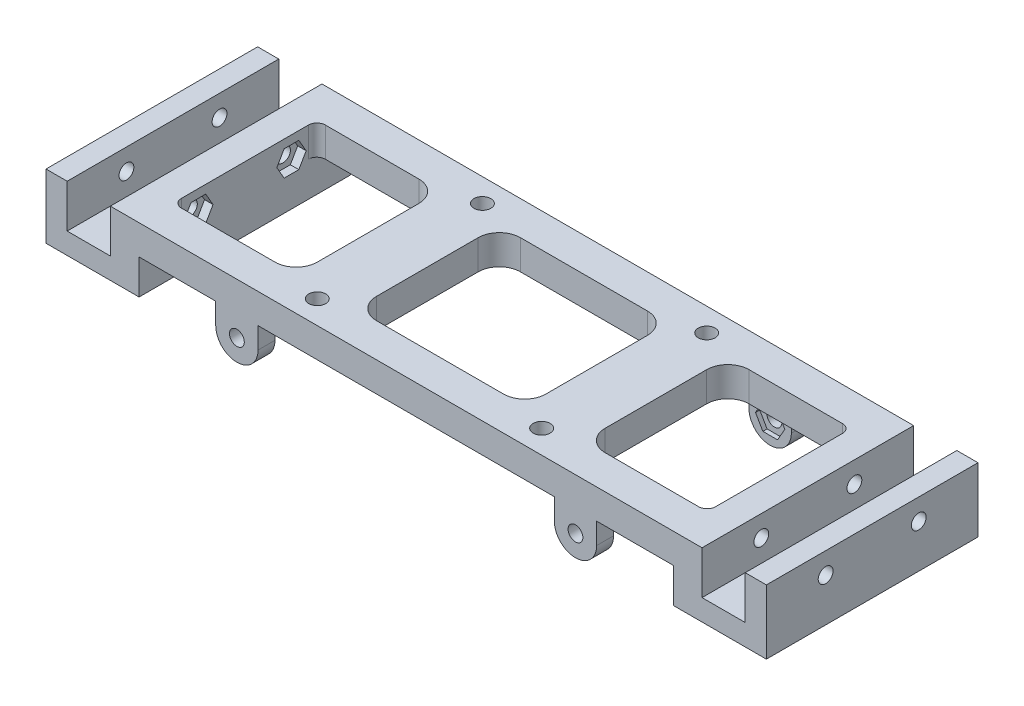
from build123d import *

# Parameters (mm, degrees)
DODANIE_WYCI_GNI_CIE1_DEPTH = 50
SZKIC2_R                    = 2
WYTNIJ_WYCI_GNI_CIE1_DEPTH  = 35
SZKIC3_W                    = 40
SZKIC3_H                    = 34
SZKIC3_W_2                  = 29.1
WYTNIJ_WYCI_GNI_CIE2_DEPTH  = 35
SZKIC4_R                    = 1.75
WYTNIJ_WYCI_GNI_CIE3_DEPTH  = 35
WYTNIJ_WYCI_GNI_CIE4_START  = -22
WYTNIJ_WYCI_GNI_CIE4_DEPTH  = 2
WYTNIJ_WYCI_GNI_CIE5_START  = -148.2
WYTNIJ_WYCI_GNI_CIE5_DEPTH  = 2
SZKIC7_R                    = 1.75
DODANIE_WYCI_GNI_CIE4_DEPTH = 4
WYTNIJ_WYCI_GNI_CIE6_DEPTH  = 1
ZAOKR_GLENIE1_R             = 2
ZAOKR_GLENIE2_R             = 5


with BuildPart() as part:
    # Szkic1 → Dodanie-wyciągnięcie1 (new body)
    with BuildSketch(Plane.XY):
        Polygon((-80.1, -5.1), (-80.1, 5.1), (-85.1, 5.1), (-85.1, -10.1), (-63.1, -10.1), (-63.1, -1.9), (63.1, -1.9), (63.1, -10.1), (85.1, -10.1), (85.1, 5.100203132), (80.100203132, 5.100203132), (80.100203132, -5.100203132), (69.899796868, -5.100203132), (69.899796868, 5.100203132), (-69.9, 5.1), (-69.9, -5.1), align=None)
    extrude(amount=DODANIE_WYCI_GNI_CIE1_DEPTH)

    # Szkic2 → Wytnij-wyciągnięcie1 (cut)
    with BuildSketch(Plane.XZ.offset(10.1)):
        with Locations(Location((-26.5, 44.5, 0), (0, 0, 180))):
            Circle(SZKIC2_R)
        with Locations(Location((-26.5, 5.5, 0), (0, 0, 180))):
            Circle(SZKIC2_R)
        with Locations(Location((26.5, 5.5, 0), (0, 0, 180))):
            Circle(SZKIC2_R)
        with Locations(Location((26.5, 44.5, 0), (0, 0, 180))):
            Circle(SZKIC2_R)
    extrude(amount=-WYTNIJ_WYCI_GNI_CIE1_DEPTH, mode=Mode.SUBTRACT)

    # Szkic3 → Wytnij-wyciągnięcie2 (cut)
    with BuildSketch(Plane.XZ.offset(10.1)):
        with Locations((0, 25)):
            Rectangle(SZKIC3_W, SZKIC3_H)
        with Locations((-48.55, 25)):
            Rectangle(SZKIC3_W_2, SZKIC3_H)
        with Locations((48.55, 25)):
            Rectangle(SZKIC3_W_2, SZKIC3_H)
    extrude(amount=-WYTNIJ_WYCI_GNI_CIE2_DEPTH, mode=Mode.SUBTRACT)

    # Szkic4 → Wytnij-wyciągnięcie3 (cut)
    with BuildSketch(Plane(origin=(85.1, 0, 0), x_dir=(0, 0, -1), z_dir=(1, 0, 0))):
        with Locations((-36, 0.100203132)):
            Circle(SZKIC4_R)
        with Locations((-14, 0.100203132)):
            Circle(SZKIC4_R)
    wytnij_wyci_gni_cie3 = extrude(amount=-WYTNIJ_WYCI_GNI_CIE3_DEPTH, mode=Mode.SUBTRACT)

    # Szkic5 → Wytnij-wyciągnięcie4 (cut)
    with BuildSketch(Plane(origin=(85.1, 0, 0), x_dir=(0, 0, -1), z_dir=(1, 0, 0)).offset(WYTNIJ_WYCI_GNI_CIE4_START)):
        Polygon((-34.267949192, 3.100203132), (-37.732050808, 3.100203132), (-39.464101615, 0.100203132), (-37.732050808, -2.899796868), (-34.267949192, -2.899796868), (-32.535898385, 0.100203132), align=None)
        Polygon((-12.267949192, 3.100203132), (-15.732050808, 3.100203132), (-17.464101615, 0.100203132), (-15.732050808, -2.899796868), (-12.267949192, -2.899796868), (-10.535898385, 0.100203132), align=None)
    extrude(amount=WYTNIJ_WYCI_GNI_CIE4_DEPTH, mode=Mode.SUBTRACT)

    # Lustro1: Wytnij-wyciągnięcie3 across plane
    add(wytnij_wyci_gni_cie3.mirror(Plane(origin=(0, 0, 0), x_dir=(0, 0, 1), z_dir=(1, 0, 0))), mode=Mode.SUBTRACT)

    # Szkic5<2> → Wytnij-wyciągnięcie5 (cut)
    with BuildSketch(Plane(origin=(85.1, 0, 0), x_dir=(0, 0, -1), z_dir=(1, 0, 0)).offset(WYTNIJ_WYCI_GNI_CIE5_START)):
        Polygon((-34.267949192, 3.100203132), (-37.732050808, 3.100203132), (-39.464101615, 0.100203132), (-37.732050808, -2.899796868), (-34.267949192, -2.899796868), (-32.535898385, 0.100203132), align=None)
        Polygon((-12.267949192, 3.100203132), (-15.732050808, 3.100203132), (-17.464101615, 0.100203132), (-15.732050808, -2.899796868), (-12.267949192, -2.899796868), (-10.535898385, 0.100203132), align=None)
    extrude(amount=-WYTNIJ_WYCI_GNI_CIE5_DEPTH, mode=Mode.SUBTRACT)

    # Szkic7 → Dodanie-wyciągnięcie4 (add)
    # profile 1 of 2: a face of its own
    with BuildSketch(Plane.XY.offset(50)):
        with BuildLine():
            Line((-34.999927458, -1.9), (-44.999927458, -1.9))
            Line((-44.999927458, -1.9), (-44.999927458, -6.9))
            ThreePointArc((-44.999927458, -6.9), (-39.999927458, -11.9), (-34.999927458, -6.9))
            Line((-34.999927458, -6.9), (-34.999927458, -1.9))
        make_face()
        with Locations((-39.999927458, -6.9)):
            Circle(SZKIC7_R, mode=Mode.SUBTRACT)
    # profile 2 of 2: a face of its own
    with BuildSketch(Plane.XY.offset(50)):
        with BuildLine():
            Line((35.000072542, -1.9), (35.000072542, -6.9))
            ThreePointArc((35.000072542, -6.9), (40.000072542, -11.9), (45.000072542, -6.9))
            Line((45.000072542, -6.9), (45.000072542, -1.9))
            Line((45.000072542, -1.9), (35.000072542, -1.9))
        make_face()
        with Locations((40.000072542, -6.9)):
            Circle(SZKIC7_R, mode=Mode.SUBTRACT)
    dodanie_wyci_gni_cie4 = extrude(amount=-DODANIE_WYCI_GNI_CIE4_DEPTH)

    # Szkic8 → Wytnij-wyciągnięcie6 (cut)
    with BuildSketch(Plane(origin=(0, 0, 46), x_dir=(-1, 0, 0), z_dir=(0, 0, -1))):
        Polygon((43.464029073, -6.9), (41.731978266, -3.9), (38.26787665, -3.9), (36.535825843, -6.9), (38.26787665, -9.9), (41.731978266, -9.9), align=None)
        Polygon((-36.535970927, -6.9), (-38.268021734, -3.9), (-41.73212335, -3.9), (-43.464174157, -6.9), (-41.73212335, -9.9), (-38.268021734, -9.9), align=None)
    wytnij_wyci_gni_cie6 = extrude(amount=-WYTNIJ_WYCI_GNI_CIE6_DEPTH, mode=Mode.SUBTRACT)

    # Lustro3: Dodanie-wyciągnięcie4, Wytnij-wyciągnięcie6 across plane
    add(dodanie_wyci_gni_cie4.mirror(Plane(origin=(0, 0, 25), x_dir=(1, 0, 0), z_dir=(0, 0, -1))))
    add(wytnij_wyci_gni_cie6.mirror(Plane(origin=(0, 0, 25), x_dir=(1, 0, 0), z_dir=(0, 0, -1))), mode=Mode.SUBTRACT)

    # Zaokrąglenie1
    zaokr_glenie1_edges = [part.edges().sort_by_distance(p)[0] for p in [
        (-63.1, 1.60000494, 8),
        (-63.1, 1.60000494, 42),
        (63.1, 1.600096626, 42),
        (63.1, 1.600096626, 8),
    ]]
    fillet(zaokr_glenie1_edges, radius=ZAOKR_GLENIE1_R)

    # Zaokrąglenie2
    zaokr_glenie2_edges = [part.edges().sort_by_distance(p)[0] for p in [
        (-34, 1.600026082, 8),
        (20, 1.600065313, 42),
        (20, 1.600065313, 8),
        (-20, 1.600036253, 8),
        (-20, 1.600036253, 42),
        (34, 1.600075485, 8),
        (34, 1.600075485, 42),
        (-34, 1.600026082, 42),
    ]]
    fillet(zaokr_glenie2_edges, radius=ZAOKR_GLENIE2_R)


solid = part.part
